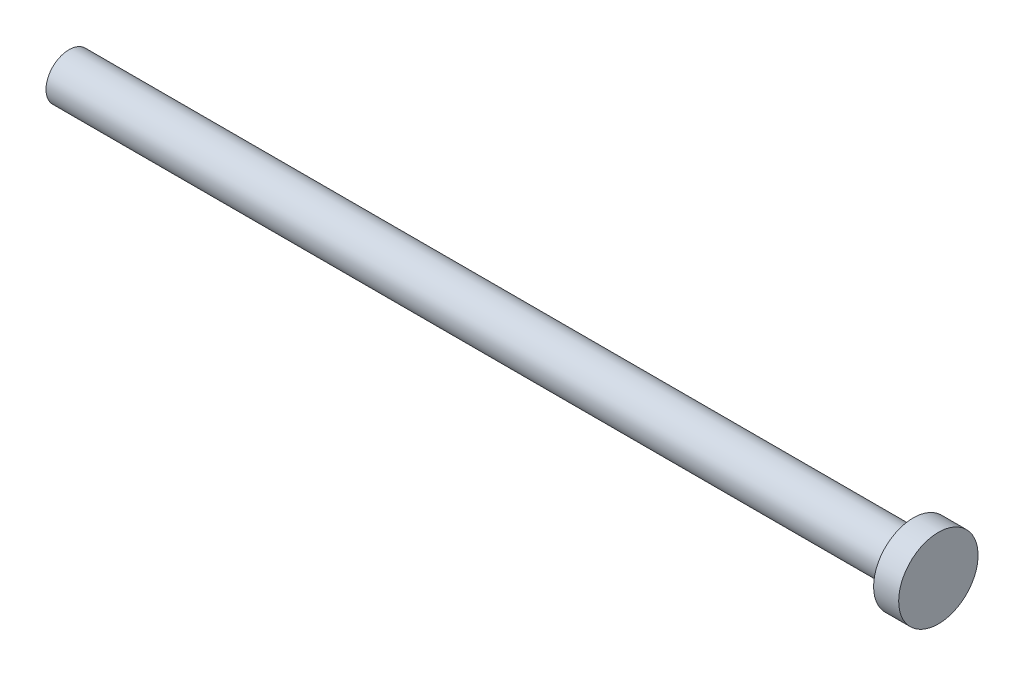
from build123d import *


with BuildPart() as part:
    # Sketch1 → Revolve1 (revolve)
    with BuildSketch(Plane.XY, mode=Mode.PRIVATE) as revolve1_sk:
        Polygon((-26.416, 0), (26.416, 0), (26.416, 2.413), (24.892, 2.413), (24.892, 1.397), (-26.416, 1.397), align=None)
    revolve(revolve1_sk.sketch.rotate(Axis((-101.547873598, 0, 0), (1, 0, 0)), 90), axis=Axis((-101.547873598, 0, 0), (1, 0, 0)))


solid = part.part
